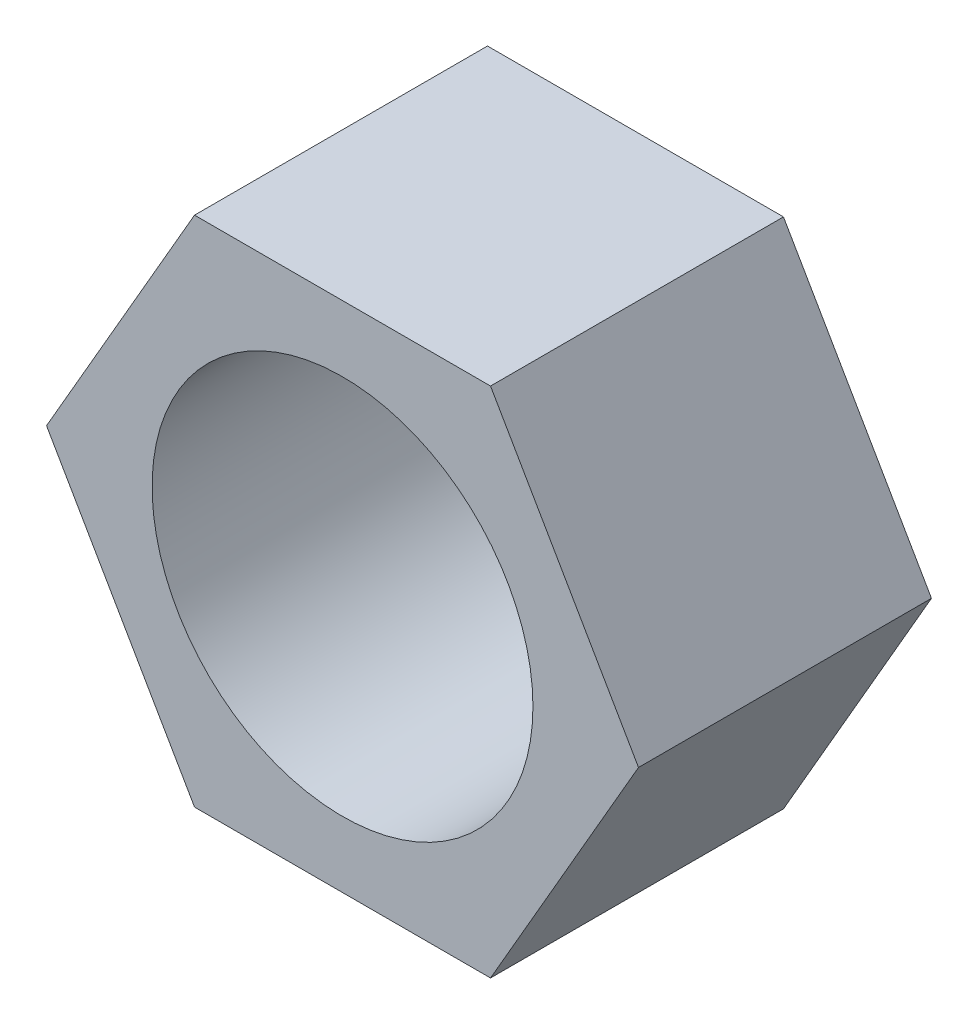
from build123d import *

# Parameters (mm, degrees)
SKETCH2_R           = 0.13
BOSS_EXTRUDE1_DEPTH = 0.2


with BuildPart() as part:
    # Sketch2 → Boss-Extrude1 (new body)
    with BuildSketch(Plane.XY):
        Polygon((0.101036297, -0.175), (0.202072594, 0), (0.101036297, 0.175), (-0.101036297, 0.175), (-0.202072594, 0), (-0.101036297, -0.175), align=None)
        Circle(SKETCH2_R, mode=Mode.SUBTRACT)
    extrude(amount=BOSS_EXTRUDE1_DEPTH)


solid = part.part
